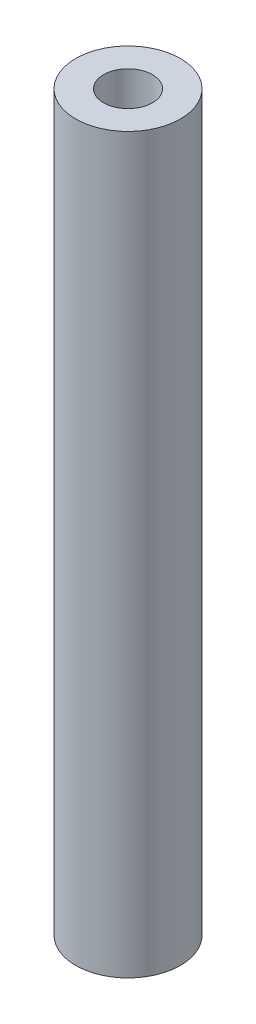
from build123d import *

# Parameters (mm, degrees)
SKETCH1_R           = 3
SKETCH1_R_2         = 1.4
BOSS_EXTRUDE1_DEPTH = 42
BOSS_EXTRUDE2_START = 10
SKETCH1_3_R         = 1.4
BOSS_EXTRUDE2_DEPTH = 22


with BuildPart() as part:
    # Sketch1 → Boss-Extrude1 (new body)
    with BuildSketch(Plane(origin=(0, 0, 0), x_dir=(1, 0, 0), z_dir=(0, 1, 0))):
        Circle(SKETCH1_R)
        Circle(SKETCH1_R_2, mode=Mode.SUBTRACT)
    extrude(amount=BOSS_EXTRUDE1_DEPTH)

    # Sketch1<3> → Boss-Extrude2 (add)
    with BuildSketch(Plane(origin=(0, 0, 0), x_dir=(1, 0, 0), z_dir=(0, 1, 0)).offset(BOSS_EXTRUDE2_START)):
        Circle(SKETCH1_3_R)
    extrude(amount=BOSS_EXTRUDE2_DEPTH)


solid = part.part
